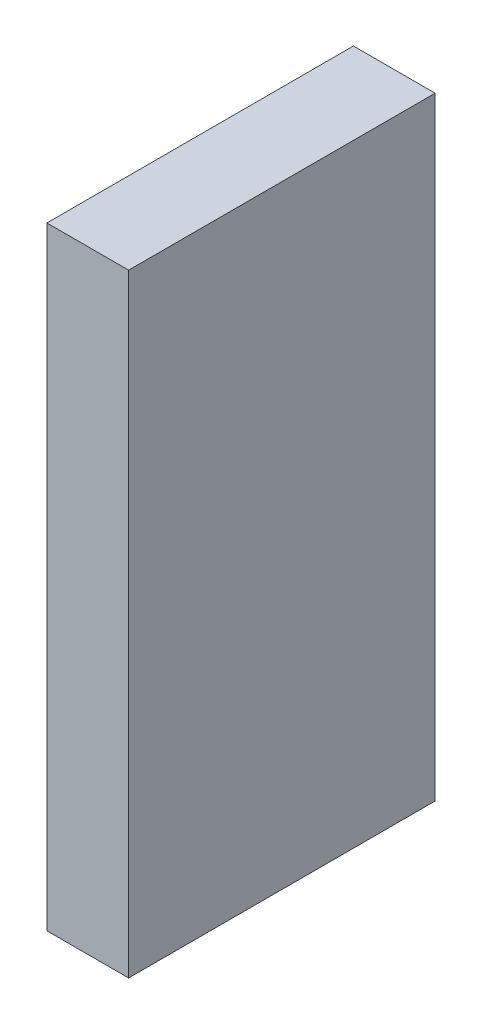
from build123d import *

# Parameters (mm, degrees)
PACK_FLAP_PARMAGI_2_1_START = -185
SKETCH1_W                   = 8
SKETCH1_H                   = 60
PACK_FLAP_PARMAGI_2_1_DEPTH = 30


with BuildPart() as part:
    # Sketch1 → PACK_flap_parmagi_2_1 (new body)
    with BuildSketch(Plane.XY.offset(PACK_FLAP_PARMAGI_2_1_START)):
        with Locations((350, 730)):
            Rectangle(SKETCH1_W, SKETCH1_H)
    extrude(amount=-PACK_FLAP_PARMAGI_2_1_DEPTH)


solid = part.part
